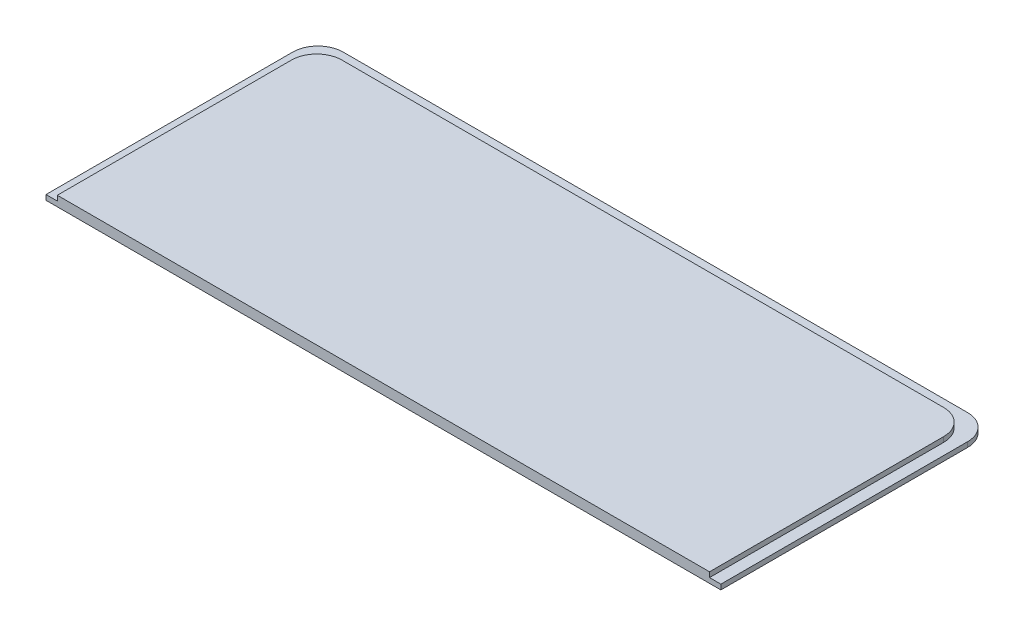
from build123d import *

# Parameters (mm, degrees)
BOSS_EXTRUDE1_DEPTH = 2
BOSS_EXTRUDE2_DEPTH = 1


with BuildPart() as part:
    # Sketch1 → Boss-Extrude1 (new body)
    with BuildSketch(Plane(origin=(0, 0, 0), x_dir=(1, 0, 0), z_dir=(0, 1, 0))):
        with BuildLine():
            Line((-59.75, 25.75), (59.75, 25.75))
            ThreePointArc((59.75, 25.75), (63.285533906, 24.285533906), (64.75, 20.75))
            Line((64.75, 20.75), (64.75, -25.75))
            Line((64.75, -25.75), (-64.75, -25.75))
            Line((-64.75, -25.75), (-64.75, 20.75))
            ThreePointArc((-64.75, 20.75), (-63.285533906, 24.285533906), (-59.75, 25.75))
        make_face()
    extrude(amount=BOSS_EXTRUDE1_DEPTH)

    # Sketch2 → Boss-Extrude2 (add)
    with BuildSketch(Plane(origin=(0, 0, 0), x_dir=(1, 0, 0), z_dir=(0, 1, 0))):
        with BuildLine():
            Line((-67, -25.75), (67, -25.75))
            Line((67, -25.75), (67, 23.25))
            ThreePointArc((67, 23.25), (65.535533906, 26.785533906), (62, 28.25))
            Line((62, 28.25), (-62, 28.25))
            ThreePointArc((-62, 28.25), (-65.535533906, 26.785533906), (-67, 23.25))
            Line((-67, 23.25), (-67, -25.75))
        make_face()
    extrude(amount=BOSS_EXTRUDE2_DEPTH)


solid = part.part
